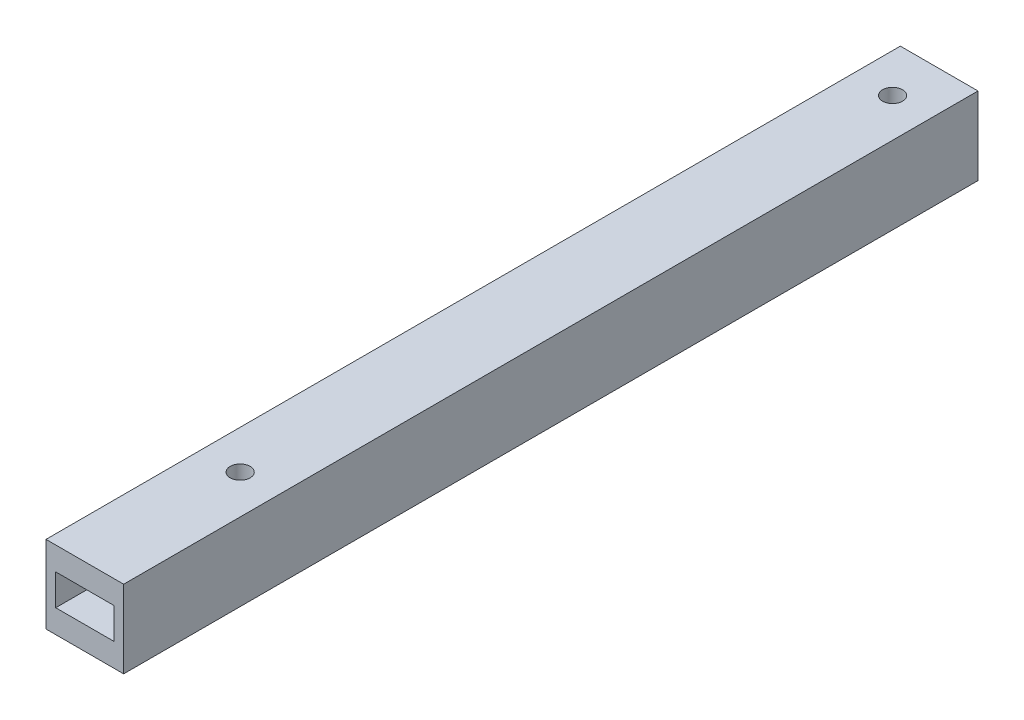
from build123d import *

# Parameters (mm, degrees)
SKETCH2_W           = 25.4
SKETCH2_H           = 25.4
BOSS_EXTRUDE1_DEPTH = 279.4
SKETCH4_W           = 19.05
SKETCH4_H           = 10.16
CUT_EXTRUDE1_DEPTH  = 280.9766776
SKETCH5_R           = 3.2639
CUT_EXTRUDE2_DEPTH  = 281.839473721
SKETCH6_R           = 3.2639
CUT_EXTRUDE3_DEPTH  = 281.839473721


with BuildPart() as part:
    # Sketch2 → Boss-Extrude1 (new body)
    with BuildSketch(Plane.XY):
        Rectangle(SKETCH2_W, SKETCH2_H)
    extrude(amount=BOSS_EXTRUDE1_DEPTH)

    # Sketch4 → Cut-Extrude1 (cut, through all)
    with BuildSketch(Plane.XY):
        Rectangle(SKETCH4_W, SKETCH4_H)
    extrude(amount=CUT_EXTRUDE1_DEPTH, mode=Mode.SUBTRACT)

    # Sketch5 → Cut-Extrude2 (cut, through all)
    with BuildSketch(Plane(origin=(0, 12.7, 0), x_dir=(1, 0, 0), z_dir=(0, 1, 0))):
        with Locations(Location((0, -15.24, 0), (0, 0, 270))):
            Circle(SKETCH5_R)
    extrude(amount=-CUT_EXTRUDE2_DEPTH, mode=Mode.SUBTRACT)

    # Sketch6 → Cut-Extrude3 (cut, through all)
    with BuildSketch(Plane(origin=(0, 12.7, 0), x_dir=(1, 0, 0), z_dir=(0, 1, 0))):
        with Locations(Location((0, -228.6, 0), (0, 0, 270))):
            Circle(SKETCH6_R)
    extrude(amount=-CUT_EXTRUDE3_DEPTH, mode=Mode.SUBTRACT)


solid = part.part
